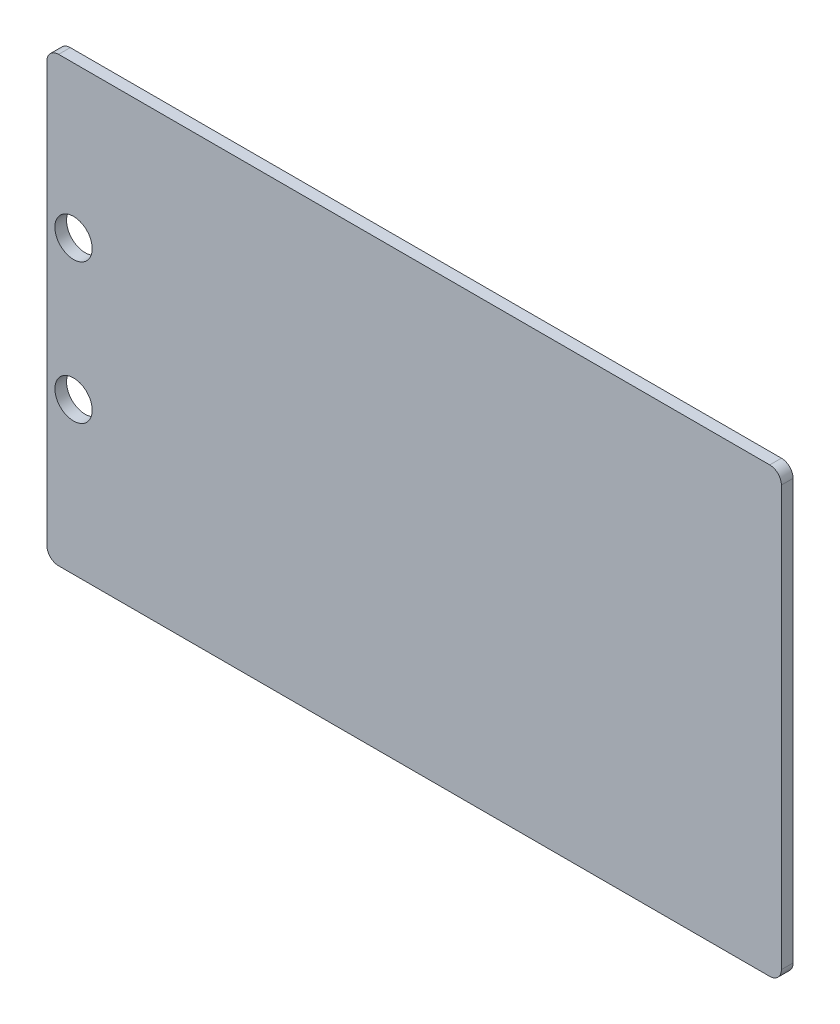
from build123d import *

# Parameters (mm, degrees)
SKETCH_1_W          = 63
SKETCH_1_H          = 38
EXTRUDE_1_DEPTH     = 1
FILLET_1_R          = 1
SKETCH_2_R          = 1.6
CUT_EXTRUDE_1_DEPTH = 2


with BuildPart() as part:
    # 草图1 → 凸台-拉伸1 (new body)
    with BuildSketch(Plane.XY):
        Rectangle(SKETCH_1_W, SKETCH_1_H)
    extrude(amount=EXTRUDE_1_DEPTH)

    # 圆角1
    fillet_1_edges = [part.edges().sort_by_distance(p)[0] for p in [
        (31.5, -19, 0.5),
        (-31.5, -19, 0.5),
        (-31.5, 19, 0.5),
        (31.5, 19, 0.5),
    ]]
    fillet(fillet_1_edges, radius=FILLET_1_R)

    # 草图2 → 切除-拉伸1 (cut)
    with BuildSketch(Plane.XY.offset(1)):
        with Locations((-29.218874675, -6)):
            Circle(SKETCH_2_R)
        with Locations((-29.218874675, 6)):
            Circle(SKETCH_2_R)
    extrude(amount=-CUT_EXTRUDE_1_DEPTH, mode=Mode.SUBTRACT)


solid = part.part
